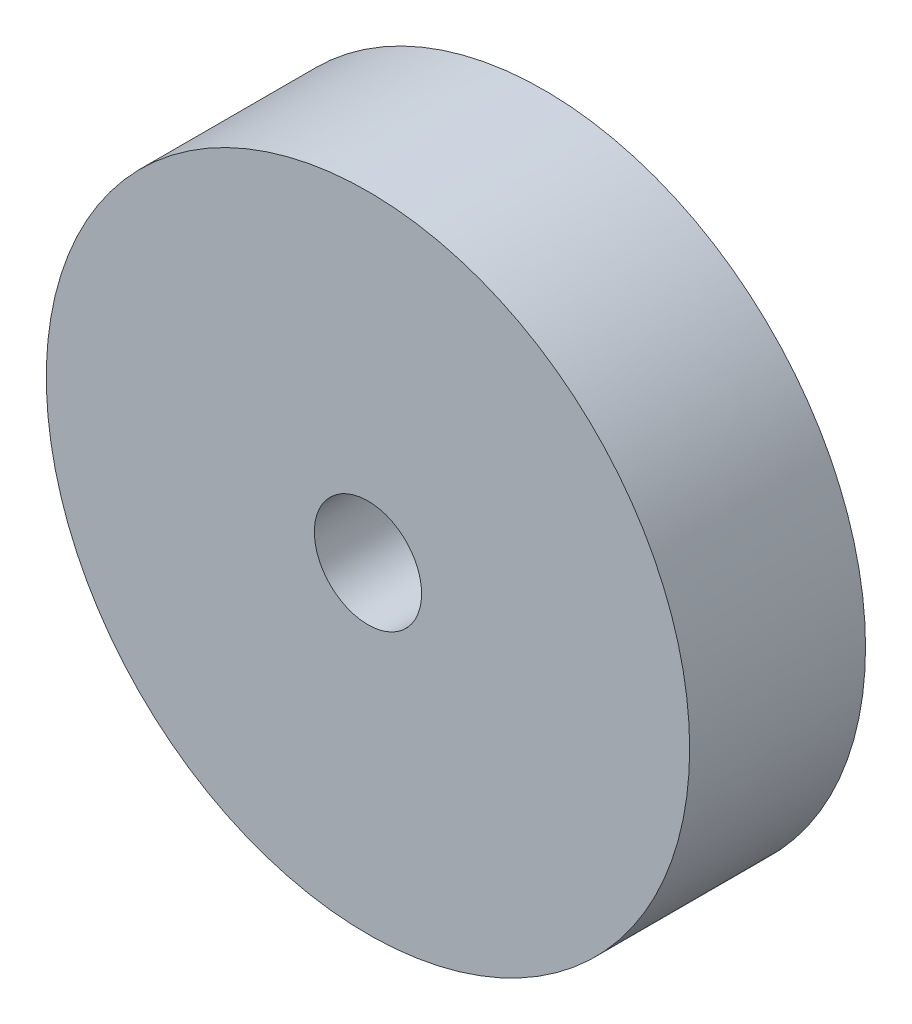
from build123d import *

# Parameters (mm, degrees)
SKETCH_1_R      = 7.5
SKETCH_1_R_2    = 1.25
EXTRUDE_1_DEPTH = 4.1


with BuildPart() as part:
    # 草圖1 → 填料-伸長1 (new body)
    with BuildSketch(Plane.XY):
        with Locations((-13.902883306, 4.645198473)):
            Circle(SKETCH_1_R)
        with Locations((-13.902883306, 4.645198473)):
            Circle(SKETCH_1_R_2, mode=Mode.SUBTRACT)
    extrude(amount=EXTRUDE_1_DEPTH)


solid = part.part
